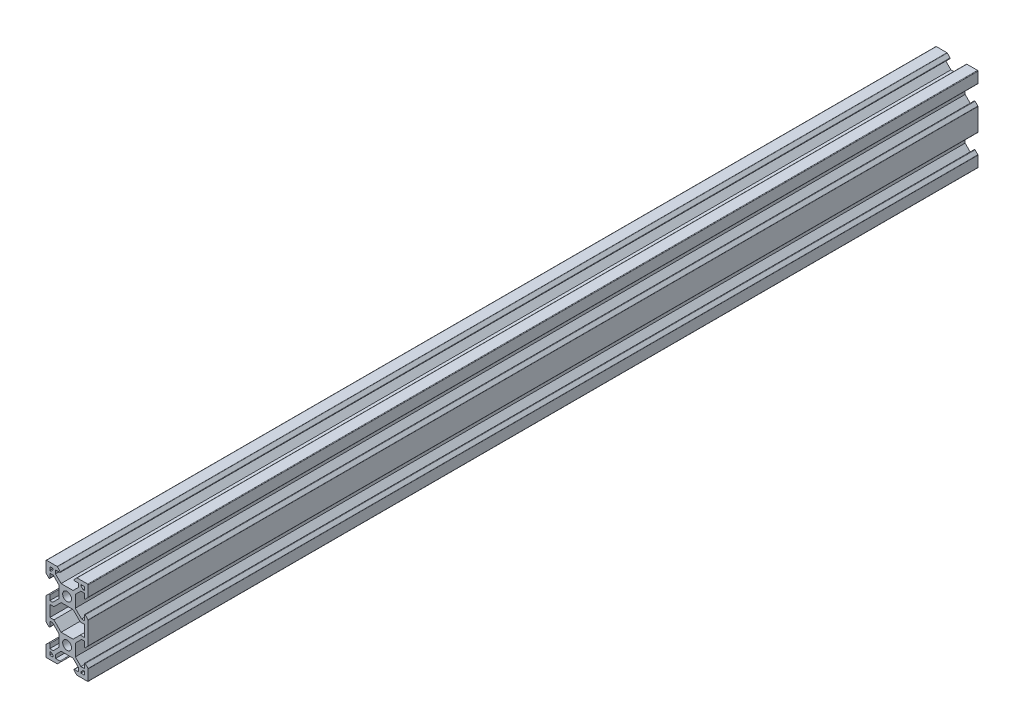
from build123d import *

# Parameters (mm, degrees)
SKETCH1_R            = 2.1
BOSS_EXTRUDE2_DEPTH  = 422
CUT_EXTRUDE1_DEPTH   = 423.236900478
FILLET1_R            = 0.25
FILLET1_OF_MIRROR1_R = 0.25


with BuildPart() as part:
    # Sketch1 → Boss-Extrude2 (new body)
    with BuildSketch(Plane.XY):
        Polygon((8.199993721, -10), (9.999993721, -10), (9.999993721, -4.63999575), (8.199993721, -2.84), (8.199993721, -5.800653822), (6.861313026, -5.800653822), (3.900652213, -2.84), (3.900652213, 2.84), (6.559993721, 5.499347787), (8.199993721, 5.499347787), (8.199993721, 2.84), (9.999993721, 4.64000425), (9.999993721, 10), (4.63999575, 10), (2.84, 8.2), (5.499325592, 8.2), (5.499325592, 6.56), (2.84, 3.900668129), (-2.84, 3.900668129), (-5.49933815, 6.56), (-5.49933815, 8.2), (-2.84, 8.2), (-4.64000425, 10), (-10.000006279, 10), (-10.000006279, 4.63999575), (-8.200006279, 2.84), (-8.200006279, 5.499347787), (-6.560006279, 5.499347787), (-3.900652213, 2.84), (-3.900652213, -2.84), (-6.861299044, -5.800653822), (-8.200006279, -5.800653822), (-8.200006279, -2.84), (-10.000006279, -4.64000425), (-10.000006279, -10), (-8.200006279, -10), (-8.200006279, -7.300653822), (-6.239977665, -7.300653822), (-2.84, -3.900668129), (2.84, -3.900668129), (6.239993721, -7.300653822), (8.199993721, -7.300653822), align=None)
        with Locations(Location((0, 0, 0), (0, 0, 180))):
            Circle(SKETCH1_R, mode=Mode.SUBTRACT)
    boss_extrude2 = extrude(amount=BOSS_EXTRUDE2_DEPTH)

    # Sketch2 → Cut-Extrude1 (cut, through all)
    with BuildSketch(Plane.XY.offset(422)):
        Polygon((-8.200006279, 6.569347787), (-8.200006279, 8.2), (-6.56933815, 8.2), (-6.56933815, 7.630009211), (-7.62999707, 6.569347787), align=None)
        Polygon((8.199993721, 8.2), (8.199993721, 6.569347787), (7.629987016, 6.569347787), (6.569325592, 7.630006706), (6.569325592, 8.2), align=None)
    cut_extrude1 = extrude(amount=-CUT_EXTRUDE1_DEPTH, mode=Mode.SUBTRACT)

    # Fillet1
    fillet1_edges = [part.edges().sort_by_distance(p)[0] for p in [
        (9.999993721, -4.63999575, 211),
        (-10.000006279, -4.64000425, 211),
        (-8.200006279, -2.84, 211),
        (-8.200006279, 2.84, 211),
        (-10.000006279, 4.63999575, 211),
        (-10.000006279, 10, 211),
        (-4.64000425, 10, 211),
        (-2.84, 8.2, 211),
        (2.84, 8.2, 211),
        (4.63999575, 10, 211),
        (9.999993721, 10, 211),
        (9.999993721, 4.64000425, 211),
        (8.199993721, 2.84, 211),
        (8.199993721, -2.84, 211),
    ]]
    fillet(fillet1_edges, radius=FILLET1_R)

    # Mirror1: Boss-Extrude2 across plane
    add(boss_extrude2.mirror(Plane(origin=(0, -10, 0), x_dir=(0, 0, 1), z_dir=(0, -1, 0))))

    # Fillet1 of Mirror1
    fillet1_of_mirror1_edges = [part.edges().sort_by_distance(p)[0] for p in [
        (9.999993721, -15.36000425, 211),
        (-10.000006279, -15.35999575, 211),
        (-8.200006279, -17.16, 211),
        (-8.200006279, -22.84, 211),
        (-10.000006279, -24.63999575, 211),
        (-10.000006279, -30, 211),
        (-4.64000425, -30, 211),
        (-2.84, -28.2, 211),
        (2.84, -28.2, 211),
        (4.63999575, -30, 211),
        (9.999993721, -30, 211),
        (9.999993721, -24.64000425, 211),
        (8.199993721, -22.84, 211),
        (8.199993721, -17.16, 211),
    ]]
    fillet(fillet1_of_mirror1_edges, radius=FILLET1_OF_MIRROR1_R)

    # Mirror2: Cut-Extrude1 across plane
    add(cut_extrude1.mirror(Plane(origin=(0, -10, 0), x_dir=(0, 0, 1), z_dir=(0, -1, 0))), mode=Mode.SUBTRACT)


solid = part.part
